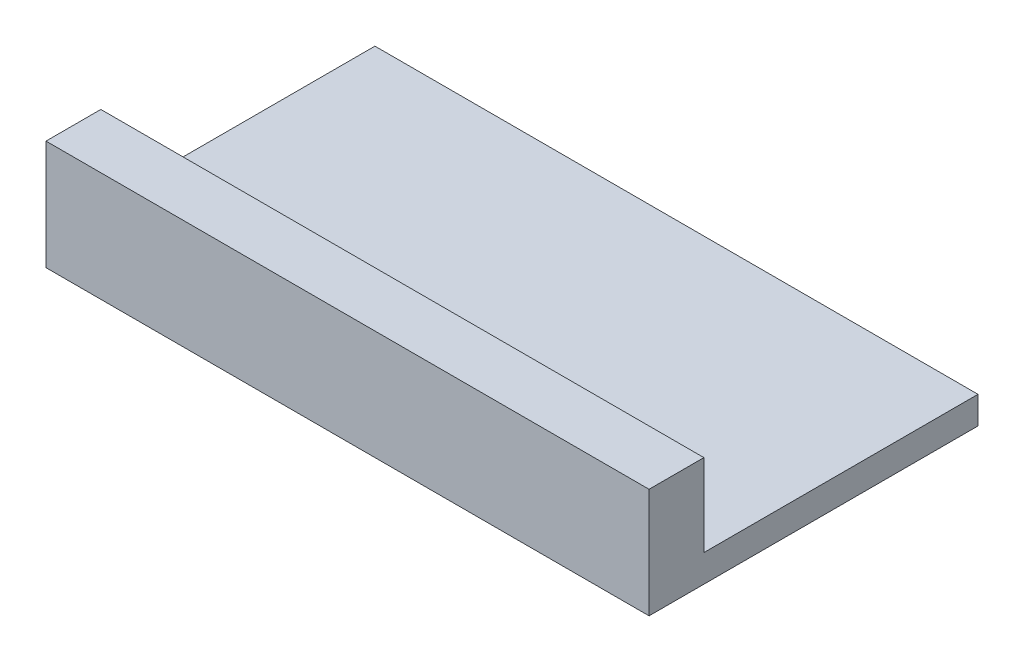
from build123d import *

# Parameters (mm, degrees)
SKETCH1_W           = 139.7
SKETCH1_H           = 76.2
BOSS_EXTRUDE1_DEPTH = 6.35
SKETCH2_W           = 139.7
SKETCH2_H           = 12.7
BOSS_EXTRUDE2_DEPTH = 19.05
SKETCH3_R           = 2.032
CUT_EXTRUDE1_DEPTH  = 82.814026915
CUT_EXTRUDE2_DEPTH  = 3.048


with BuildPart() as part:
    # Sketch1 → Boss-Extrude1 (new body)
    with BuildSketch(Plane(origin=(0, 0, 0), x_dir=(1, 0, 0), z_dir=(0, 1, 0))):
        Rectangle(SKETCH1_W, SKETCH1_H)
    extrude(amount=BOSS_EXTRUDE1_DEPTH)

    # Sketch2 → Boss-Extrude2 (add)
    with BuildSketch(Plane(origin=(0, 6.35, 0), x_dir=(1, 0, 0), z_dir=(0, 1, 0))):
        with Locations((0, -31.75)):
            Rectangle(SKETCH2_W, SKETCH2_H)
    extrude(amount=BOSS_EXTRUDE2_DEPTH)

    # Sketch3 → Cut-Extrude1 (cut, through all)
    with BuildSketch(Plane(origin=(0, 6.35, 0), x_dir=(1, 0, 0), z_dir=(0, 1, 0))):
        with Locations(Location((-53.34, -21.59, 0), (0, 0, 270))):
            Circle(SKETCH3_R)
    extrude(amount=-CUT_EXTRUDE1_DEPTH, mode=Mode.SUBTRACT)

    # Sketch4 → Cut-Extrude2 (cut)
    with BuildSketch(Plane.XZ):
        Polygon((-50.927, 25.769438599), (-55.753, 25.769438599), (-58.166, 21.59), (-55.753, 17.410561401), (-50.927, 17.410561401), (-48.514, 21.59), align=None)
    extrude(amount=-CUT_EXTRUDE2_DEPTH, mode=Mode.SUBTRACT)


solid = part.part
